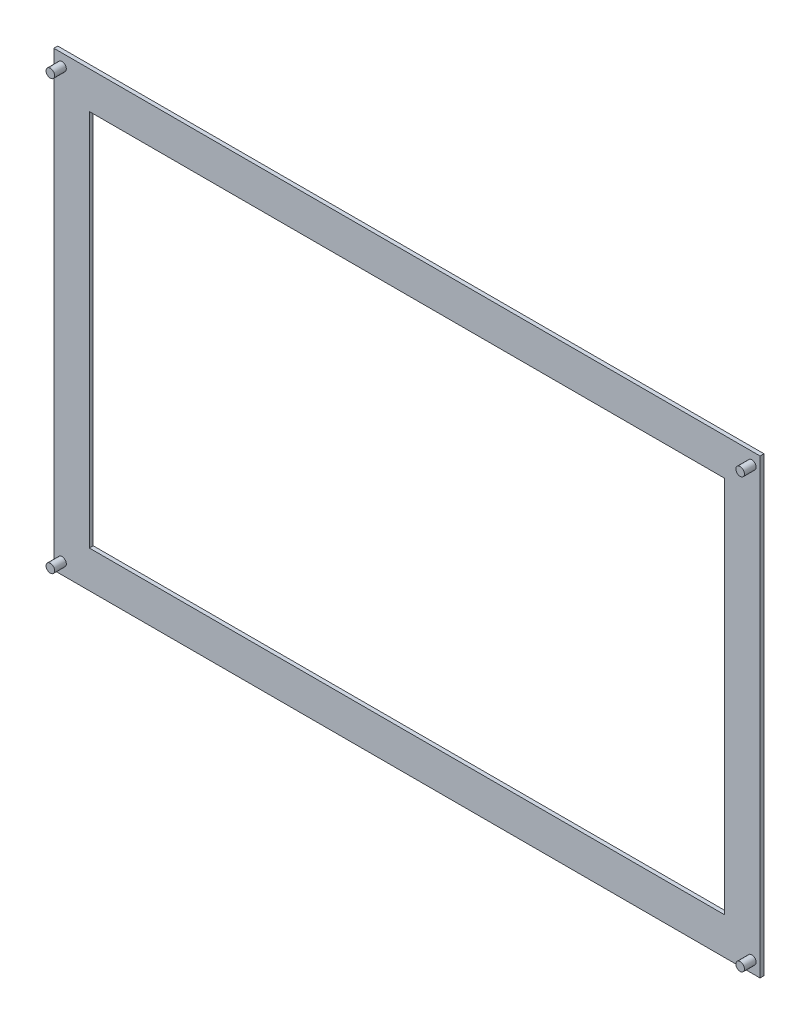
from build123d import *

# Parameters (mm, degrees)
SKETCH_1_W          = 181.2
SKETCH_1_H          = 116
EXTRUDE_1_DEPTH     = 1
SKETCH_2_W          = 163
SKETCH_2_H          = 97
CUT_EXTRUDE_1_DEPTH = 1
SKETCH_3_R          = 1.1
EXTRUDE_2_DEPTH     = 3


with BuildPart() as part:
    # 草图1 → 凸台-拉伸1 (new body)
    with BuildSketch(Plane.XY):
        Rectangle(SKETCH_1_W, SKETCH_1_H)
    extrude(amount=EXTRUDE_1_DEPTH)

    # 草图2 → 切除-拉伸1 (cut)
    with BuildSketch(Plane.XY.offset(1)):
        Rectangle(SKETCH_2_W, SKETCH_2_H)
    extrude(amount=-CUT_EXTRUDE_1_DEPTH, mode=Mode.SUBTRACT)

    # 草图3 → 凸台-拉伸2 (add)
    with BuildSketch(Plane.XY.offset(1)):
        with Locations((-88.5, 55)):
            Circle(SKETCH_3_R)
        with Locations((-88.5, -55)):
            Circle(SKETCH_3_R)
        with Locations((88.5, -55)):
            Circle(SKETCH_3_R)
        with Locations((88.5, 55)):
            Circle(SKETCH_3_R)
    extrude(amount=EXTRUDE_2_DEPTH)


solid = part.part
